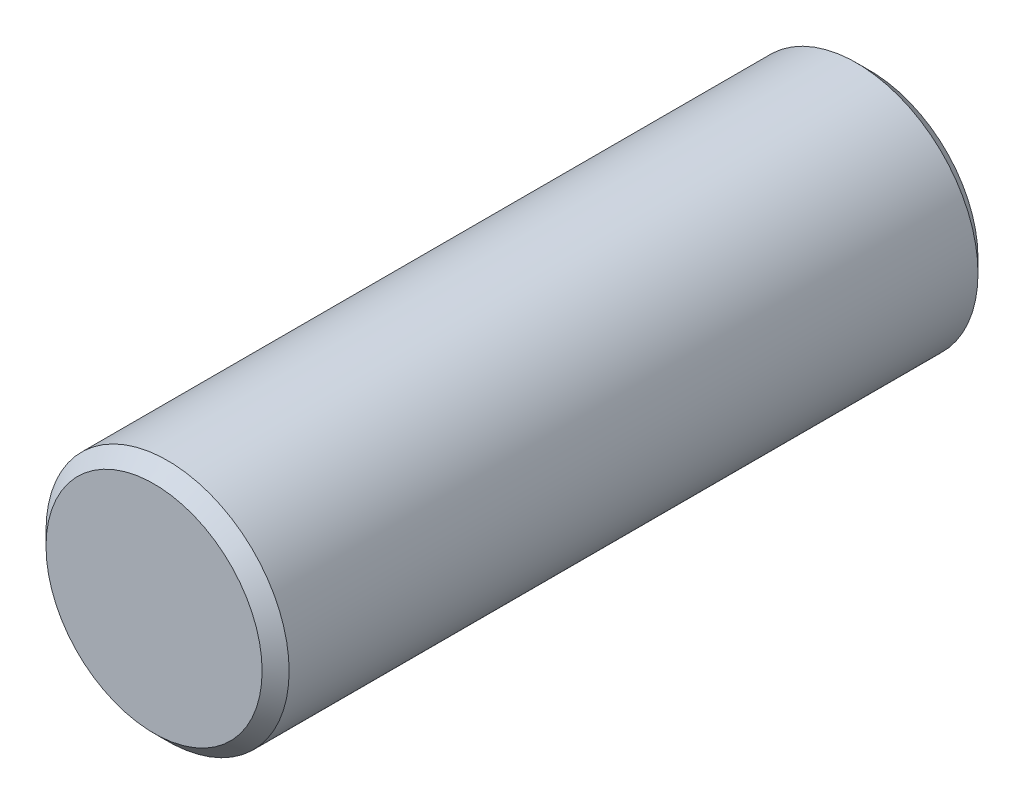
from build123d import *

# Parameters (mm, degrees)
IZIM1_R                     = 9
Y_KSEKLIK_EKSTR_ZYON1_DEPTH = 53
PAH1_SIZE                   = 1


with BuildPart() as part:
    # Çizim1 → Yükseklik-Ekstrüzyon1 (new body)
    with BuildSketch(Plane.XY):
        Circle(IZIM1_R)
    extrude(amount=Y_KSEKLIK_EKSTR_ZYON1_DEPTH)

    # Pah1
    pah1_edges = [part.edges().sort_by_distance(p)[0] for p in [
        (-9, 0, 0),
        (-9, 0, 53),
    ]]
    chamfer(pah1_edges, length=PAH1_SIZE)


solid = part.part
